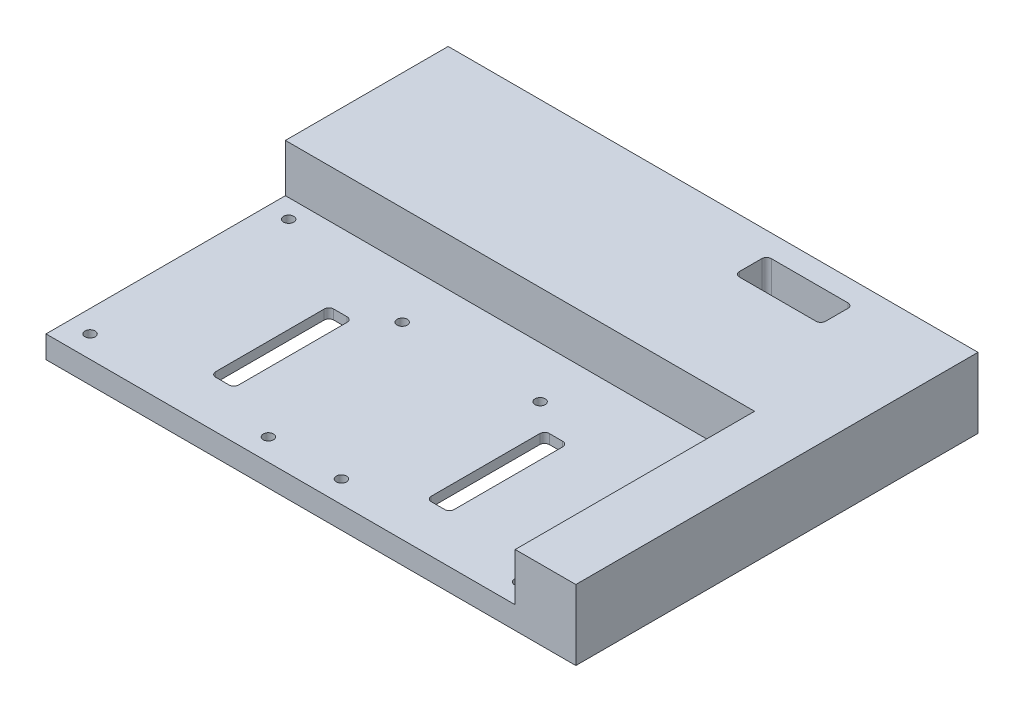
from build123d import *

# Parameters (mm, degrees)
SKETCH1_W           = 166
SKETCH1_H           = 126
BOSS_EXTRUDE1_DEPTH = 7
BOSS_EXTRUDE2_DEPTH = 15
CUT_EXTRUDE1_REACH  = 107.276
SKETCH4_R           = 1.6
CUT_EXTRUDE2_DEPTH  = 106.275828185
SKETCH5_R           = 4
CUT_EXTRUDE3_DEPTH  = 4
CUT_EXTRUDE4_DEPTH  = 107.498826285
CUT_EXTRUDE5_DEPTH  = 3
CUT_EXTRUDE6_DEPTH  = 2
BOSS_EXTRUDE3_DEPTH = 2


with BuildPart() as part:
    # Sketch1 → Boss-Extrude1 (new body)
    with BuildSketch(Plane(origin=(0, 0, 0), x_dir=(1, 0, 0), z_dir=(0, 1, 0))):
        Rectangle(SKETCH1_W, SKETCH1_H)
    extrude(amount=BOSS_EXTRUDE1_DEPTH)

    # Sketch2 → Boss-Extrude2 (add)
    with BuildSketch(Plane(origin=(0, 7, 0), x_dir=(1, 0, 0), z_dir=(0, 1, 0))):
        Polygon((-83, 63), (-83, 12), (64, 12), (64, -63), (83, -63), (83, 63), align=None)
    extrude(amount=BOSS_EXTRUDE2_DEPTH)

    # Sketch3 → Cut-Extrude1 (cut, up to next)
    with BuildSketch(Plane(origin=(0, 7, 0), x_dir=(1, 0, 0), z_dir=(0, 1, 0)), mode=Mode.PRIVATE) as cut_extrude1_sk1:
        with BuildLine():
            Line((-44.67, -11.18), (-40.47, -11.18))
            ThreePointArc((-40.47, -11.18), (-39.409339828, -11.619339828), (-38.97, -12.68))
            Line((-38.97, -12.68), (-38.97, -46.68))
            ThreePointArc((-38.97, -46.68), (-39.409339828, -47.740660172), (-40.47, -48.18))
            Line((-40.47, -48.18), (-44.67, -48.18))
            ThreePointArc((-44.67, -48.18), (-45.730660172, -47.740660172), (-46.17, -46.68))
            Line((-46.17, -46.68), (-46.17, -12.68))
            ThreePointArc((-46.17, -12.68), (-45.730660172, -11.619339828), (-44.67, -11.18))
        make_face()
    cut_extrude1_tool1 = extrude(cut_extrude1_sk1.sketch, amount=-CUT_EXTRUDE1_REACH, mode=Mode.PRIVATE) & part.part
    # Sketch3 → Cut-Extrude1 (cut, up to next)
    with BuildSketch(Plane(origin=(0, 7, 0), x_dir=(1, 0, 0), z_dir=(0, 1, 0)), mode=Mode.PRIVATE) as cut_extrude1_sk2:
        with BuildLine():
            Line((22.89, -11.19), (27.09, -11.19))
            ThreePointArc((27.09, -11.19), (28.150660172, -11.629339828), (28.59, -12.69))
            Line((28.59, -12.69), (28.59, -46.69))
            ThreePointArc((28.59, -46.69), (28.150660172, -47.750660172), (27.09, -48.19))
            Line((27.09, -48.19), (22.89, -48.19))
            ThreePointArc((22.89, -48.19), (21.829339828, -47.750660172), (21.39, -46.69))
            Line((21.39, -46.69), (21.39, -12.69))
            ThreePointArc((21.39, -12.69), (21.829339828, -11.629339828), (22.89, -11.19))
        make_face()
    cut_extrude1_tool2 = extrude(cut_extrude1_sk2.sketch, amount=-CUT_EXTRUDE1_REACH, mode=Mode.PRIVATE) & part.part
    add(cut_extrude1_tool1.solids().sort_by_distance((-42.57, 7, 29.68))[0], mode=Mode.SUBTRACT)
    add(cut_extrude1_tool2.solids().sort_by_distance((24.99, 7, 29.69))[0], mode=Mode.SUBTRACT)

    # Sketch4 → Cut-Extrude2 (cut, through all)
    with BuildSketch(Plane(origin=(0, 7, 0), x_dir=(1, 0, 0), z_dir=(0, 1, 0))):
        with Locations(Location((-76.1, -56.1, 0), (0, 0, 270))):
            Circle(SKETCH4_R)
        with Locations(Location((-20.22, -56.1, 0), (0, 0, 270))):
            Circle(SKETCH4_R)
        with Locations(Location((2.64, -56.1, 0), (0, 0, 270))):
            Circle(SKETCH4_R)
        with Locations(Location((58.49, -56.1, 0), (0, 0, 270))):
            Circle(SKETCH4_R)
        with Locations(Location((-76.1, 6.13, 0), (0, 0, 270))):
            Circle(SKETCH4_R)
        with Locations(Location((-30.38, -4.03, 0), (0, 0, 270))):
            Circle(SKETCH4_R)
        with Locations(Location((58.52, 6.16, 0), (0, 0, 270))):
            Circle(SKETCH4_R)
        with Locations(Location((12.8, -4, 0), (0, 0, 270))):
            Circle(SKETCH4_R)
    extrude(amount=-CUT_EXTRUDE2_DEPTH, mode=Mode.SUBTRACT)

    # Sketch5 → Cut-Extrude3 (cut)
    with BuildSketch(Plane(origin=(0, 0, 0), x_dir=(-1, 0, 0), z_dir=(0, -1, 0))):
        with BuildLine():
            Line((70.6, -58), (25.705435261, -58))
            ThreePointArc((25.705435261, -58), (24.606882494, -57.521362726), (24.209407462, -56.390909091))
            ThreePointArc((24.209407462, -56.390909091), (20.22, -52.1), (16.230592538, -56.390909091))
            ThreePointArc((16.230592538, -56.390909091), (15.833117506, -57.521362726), (14.734564739, -58))
            Line((14.734564739, -58), (2.845435261, -58))
            ThreePointArc((2.845435261, -58), (1.746882494, -57.521362726), (1.349407462, -56.390909091))
            ThreePointArc((1.349407462, -56.390909091), (-2.64, -52.1), (-6.629407462, -56.390909091))
            ThreePointArc((-6.629407462, -56.390909091), (-7.026882494, -57.521362726), (-8.125435261, -58))
            Line((-8.125435261, -58), (-53.004564739, -58))
            ThreePointArc((-53.004564739, -58), (-54.103117506, -57.521362726), (-54.500592538, -56.390909091))
            ThreePointArc((-54.500592538, -56.390909091), (-58.49, -52.1), (-62.479407462, -56.390909091))
            ThreePointArc((-62.479407462, -56.390909091), (-62.876882494, -57.521362726), (-63.975435261, -58))
            Line((-63.975435261, -58), (-76.5, -58))
            ThreePointArc((-76.5, -58), (-77.560660172, -57.560660172), (-78, -56.5))
            Line((-78, -56.5), (-78, 56.5))
            ThreePointArc((-78, 56.5), (-77.560660172, 57.560660172), (-76.5, 58))
            Line((-76.5, 58), (76.5, 58))
            ThreePointArc((76.5, 58), (77.560660172, 57.560660172), (78, 56.5))
            Line((78, 56.5), (78, 11.615435261))
            ThreePointArc((78, 11.615435261), (77.521362726, 10.516882494), (76.390909091, 10.119407462))
            ThreePointArc((76.390909091, 10.119407462), (72.1, 6.13), (76.390909091, 2.140592538))
            ThreePointArc((76.390909091, 2.140592538), (77.521362726, 1.743117506), (78, 0.644564739))
            Line((78, 0.644564739), (78, -50.6))
            ThreePointArc((78, -50.6), (77.560660172, -51.660660172), (76.5, -52.1))
            Line((76.5, -52.1), (76.1, -52.1))
            ThreePointArc((76.1, -52.1), (73.271572875, -53.271572875), (72.1, -56.1))
            Line((72.1, -56.1), (72.1, -56.5))
            ThreePointArc((72.1, -56.5), (71.660660172, -57.560660172), (70.6, -58))
        make_face()
        with Locations(Location((30.38, -4.03, 0), (0, 0, 90))):
            Circle(SKETCH5_R, mode=Mode.SUBTRACT)
        with Locations(Location((-12.8, -4, 0), (0, 0, 90))):
            Circle(SKETCH5_R, mode=Mode.SUBTRACT)
        with Locations(Location((-58.52, 6.16, 0), (0, 0, 90))):
            Circle(SKETCH5_R, mode=Mode.SUBTRACT)
    extrude(amount=-CUT_EXTRUDE3_DEPTH, mode=Mode.SUBTRACT)

    # Sketch6 → Cut-Extrude4 (cut, through all)
    with BuildSketch(Plane(origin=(0, 22, 0), x_dir=(1, 0, 0), z_dir=(0, 1, 0))):
        with BuildLine():
            Line((25.2, 56.05), (49.2, 56.05))
            ThreePointArc((49.2, 56.05), (50.260660172, 55.610660172), (50.7, 54.55))
            Line((50.7, 54.55), (50.7, 47.55))
            ThreePointArc((50.7, 47.55), (50.260660172, 46.489339828), (49.2, 46.05))
            Line((49.2, 46.05), (25.2, 46.05))
            ThreePointArc((25.2, 46.05), (24.139339828, 46.489339828), (23.7, 47.55))
            Line((23.7, 47.55), (23.7, 54.55))
            ThreePointArc((23.7, 54.55), (24.139339828, 55.610660172), (25.2, 56.05))
        make_face()
    extrude(amount=-CUT_EXTRUDE4_DEPTH, mode=Mode.SUBTRACT)

    # Sketch7 → Cut-Extrude5 (cut)
    with BuildSketch(Plane.XZ.offset(-4)):
        with BuildLine():
            Line((-27.5, -56), (-59.5, -56))
            ThreePointArc((-59.5, -56), (-60.560660172, -55.560660172), (-61, -54.5))
            Line((-61, -54.5), (-61, -27.5))
            ThreePointArc((-61, -27.5), (-60.560660172, -26.439339828), (-59.5, -26))
            Line((-59.5, -26), (-27.5, -26))
            ThreePointArc((-27.5, -26), (-26.439339828, -26.439339828), (-26, -27.5))
            Line((-26, -27.5), (-26, -54.5))
            ThreePointArc((-26, -54.5), (-26.439339828, -55.560660172), (-27.5, -56))
        make_face()
    extrude(amount=-CUT_EXTRUDE5_DEPTH, mode=Mode.SUBTRACT)

    # Sketch8 → Cut-Extrude6 (cut)
    with BuildSketch(Plane.XZ.offset(-4)):
        with BuildLine():
            Line((55.3, 45.9), (64.3, 45.9))
            ThreePointArc((64.3, 45.9), (65.360660172, 45.460660172), (65.8, 44.4))
            Line((65.8, 44.4), (65.8, 29.4))
            ThreePointArc((65.8, 29.4), (65.360660172, 28.339339828), (64.3, 27.9))
            Line((64.3, 27.9), (55.3, 27.9))
            ThreePointArc((55.3, 27.9), (54.239339828, 28.339339828), (53.8, 29.4))
            Line((53.8, 29.4), (53.8, 44.4))
            ThreePointArc((53.8, 44.4), (54.239339828, 45.460660172), (55.3, 45.9))
        make_face()
    extrude(amount=-CUT_EXTRUDE6_DEPTH, mode=Mode.SUBTRACT)

    # Sketch9 → Boss-Extrude3 (add)
    with BuildSketch(Plane(origin=(0, 4, 0), x_dir=(-1, 0, 0), z_dir=(0, -1, 0))):
        with BuildLine():
            Line((-8.082795796, -11.112795796), (6.059339828, 3.029339828))
            ThreePointArc((6.059339828, 3.029339828), (7.12, 3.468679656), (8.180660172, 3.029339828))
            Line((8.180660172, 3.029339828), (22.322795796, -11.112795796))
            ThreePointArc((22.322795796, -11.112795796), (22.762135624, -12.173455967), (22.322795796, -13.234116139))
            Line((22.322795796, -13.234116139), (8.180660172, -27.376251763))
            ThreePointArc((8.180660172, -27.376251763), (7.12, -27.815591591), (6.059339828, -27.376251763))
            Line((6.059339828, -27.376251763), (-8.082795796, -13.234116139))
            ThreePointArc((-8.082795796, -13.234116139), (-8.522135624, -12.173455967), (-8.082795796, -11.112795796))
        make_face()
    extrude(amount=BOSS_EXTRUDE3_DEPTH)


solid = part.part
